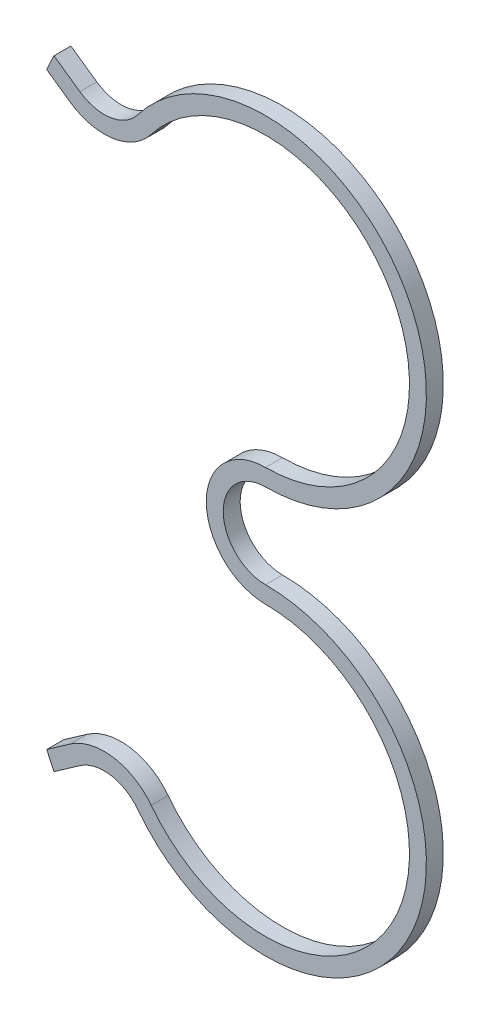
from build123d import *

# Parameters (mm, degrees)
BOSS_EXTRU_2_DEPTH      = 1
ESQUISSE2_OUTSIDE_W     = 37.018
ESQUISSE2_OUTSIDE_H     = 59.596
ENL_V_MAT_EXTRU_1_DEPTH = 27.837289407


with BuildPart() as part:
    # Esquisse1 → Boss.-Extru.2 (new body)
    with BuildSketch(Plane.XY):
        with BuildLine():
            Line((-12.922465041, 17.386083667), (-11.5420173, 16.419483753))
            ThreePointArc((-11.5420173, 16.419483753), (-8.998687611, 15.827772592), (-6.753604006, 17.161282102))
            ThreePointArc((-6.753604006, 17.161282102), (7.619740739, 15.766902052), (0, 3.5))
            ThreePointArc((0, 3.5), (-3.5, 0), (0, -3.5))
            ThreePointArc((0, -3.5), (7.619740739, -15.766902052), (-6.753604006, -17.161282102))
            ThreePointArc((-6.753604006, -17.161282102), (-8.998687611, -15.827772592), (-11.5420173, -16.419483753))
            Line((-11.5420173, -16.419483753), (-12.922465041, -17.386083667))
            ThreePointArc((-12.922465041, -17.386083667), (-12.266740841, -18.747374982), (-11.46812862, -20.030070109))
            Line((-11.46812862, -20.030070109), (-9.821287991, -18.876939886))
            ThreePointArc((-9.821287991, -18.876939886), (-9.457955178, -18.79240972), (-9.137228949, -18.982911079))
            ThreePointArc((-9.137228949, -18.982911079), (10.309061, -17.096396894), (0, -0.5))
            ThreePointArc((0, -0.5), (-0.5, 0), (0, 0.5))
            ThreePointArc((0, 0.5), (10.309061, 17.096396894), (-9.137228949, 18.982911079))
            ThreePointArc((-9.137228949, 18.982911079), (-9.457955178, 18.79240972), (-9.821287991, 18.876939886))
            Line((-9.821287991, 18.876939886), (-11.46812862, 20.030070109))
            ThreePointArc((-11.46812862, 20.030070109), (-12.266740841, 18.747374982), (-12.922465041, 17.386083667))
        make_face()
    extrude(amount=BOSS_EXTRU_2_DEPTH)

    # Esquisse2 outside → Enlèv. mat.-Extru.1 (cut, through all)
    with BuildSketch(Plane.XY.offset(1)):
        with Locations((-0.711, 0)):
            Rectangle(ESQUISSE2_OUTSIDE_W, ESQUISSE2_OUTSIDE_H)
        with BuildLine():
            Line((-12.922465041, 17.386083667), (-11.5420173, 16.419483753))
            ThreePointArc((-11.5420173, 16.419483753), (-8.998687611, 15.827772592), (-6.753604006, 17.161282102))
            ThreePointArc((-6.753604006, 17.161282102), (7.619740739, 15.766902052), (0, 3.5))
            ThreePointArc((0, 3.5), (-3.5, 0), (0, -3.5))
            ThreePointArc((0, -3.5), (7.619740739, -15.766902052), (-6.753604006, -17.161282102))
            ThreePointArc((-6.753604006, -17.161282102), (-8.998687611, -15.827772592), (-11.5420173, -16.419483753))
            Line((-11.5420173, -16.419483753), (-12.922465041, -17.386083667))
            Line((-12.922465041, -17.386083667), (-12.979954825, -18.647113037))
            Line((-12.979954825, -18.647113037), (-12.348888604, -18.205235712))
            Line((-12.348888604, -18.205235712), (-10.968440864, -17.238635798))
            ThreePointArc((-10.968440864, -17.238635798), (-9.1517768, -16.815984968), (-7.548145653, -17.768491761))
            ThreePointArc((-7.548145653, -17.768491761), (8.516180826, -16.210066999), (0, -2.5))
            ThreePointArc((0, -2.5), (-2.5, 0), (0, 2.5))
            ThreePointArc((0, 2.5), (8.516180826, 16.210066999), (-7.548145653, 17.768491761))
            ThreePointArc((-7.548145653, 17.768491761), (-9.1517768, 16.815984968), (-10.968440864, 17.238635798))
            Line((-10.968440864, 17.238635798), (-12.348888604, 18.205235712))
            Line((-12.348888604, 18.205235712), (-12.898926694, 18.590376529))
            Line((-12.898926694, 18.590376529), (-13.29562882, 18.205235712))
            Line((-13.29562882, 18.205235712), (-12.922465041, 17.386083667))
        make_face(mode=Mode.SUBTRACT)
    extrude(amount=-ENL_V_MAT_EXTRU_1_DEPTH, mode=Mode.SUBTRACT)


solid = part.part
